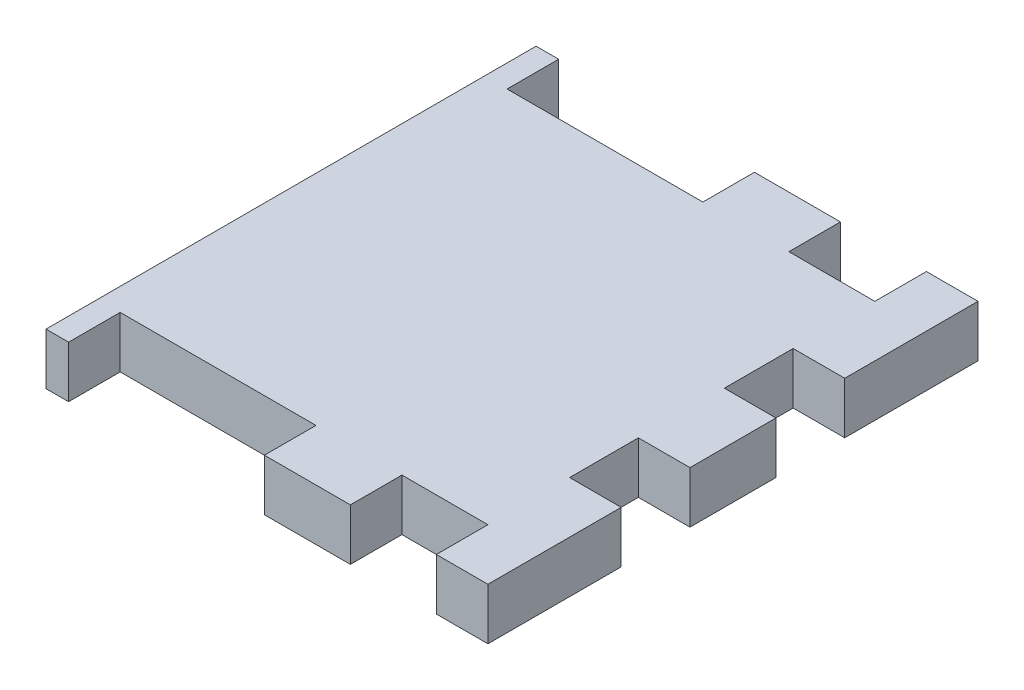
from build123d import *

# Parameters (mm, degrees)
SKETCH1_W           = 25.7
SKETCH1_H           = 28.5
BOSS_EXTRUDE1_DEPTH = 3
SKETCH3_W           = 5
SKETCH3_H           = 3
SKETCH3_W_2         = 2
SKETCH3_W_3         = 3
SKETCH3_H_2         = 4
CUT_EXTRUDE2_DEPTH  = 10
SKETCH2_W           = 5
SKETCH2_H           = 4.84993503
CUT_EXTRUDE3_DEPTH  = 3


with BuildPart() as part:
    # Sketch1 → Boss-Extrude1 (new body)
    with BuildSketch(Plane(origin=(0, 0, 0), x_dir=(1, 0, 0), z_dir=(0, 1, 0))):
        Rectangle(SKETCH1_W, SKETCH1_H)
    extrude(amount=BOSS_EXTRUDE1_DEPTH)

    # Sketch3 → Cut-Extrude2 (cut)
    with BuildSketch(Plane.XZ):
        with Locations((7.35, -12.75)):
            Rectangle(SKETCH3_W, SKETCH3_H)
        with Locations((-2.65, -12.75)):
            Rectangle(SKETCH3_W, SKETCH3_H)
        with Locations((-2.65, 12.75)):
            Rectangle(SKETCH3_W, SKETCH3_H)
        with Locations((7.35, 12.75)):
            Rectangle(SKETCH3_W, SKETCH3_H)
        with Locations((-10.536209453, 12.75)):
            Rectangle(SKETCH3_W_2, SKETCH3_H)
        with Locations((-10.536209453, -12.75)):
            Rectangle(SKETCH3_W_2, SKETCH3_H)
        with Locations((11.35, -4.5)):
            Rectangle(SKETCH3_W_3, SKETCH3_H_2)
        with Locations((11.35, 4.5)):
            Rectangle(SKETCH3_W_3, SKETCH3_H_2)
    extrude(amount=-CUT_EXTRUDE2_DEPTH, mode=Mode.SUBTRACT)

    # Sketch2 → Cut-Extrude3 (cut)
    with BuildSketch(Plane.XZ):
        with Locations((-7.35, -13.674967515)):
            Rectangle(SKETCH2_W, SKETCH2_H)
        with Locations((-7.35, 13.674967515)):
            Rectangle(SKETCH2_W, SKETCH2_H)
    extrude(amount=-CUT_EXTRUDE3_DEPTH, mode=Mode.SUBTRACT)


solid = part.part
